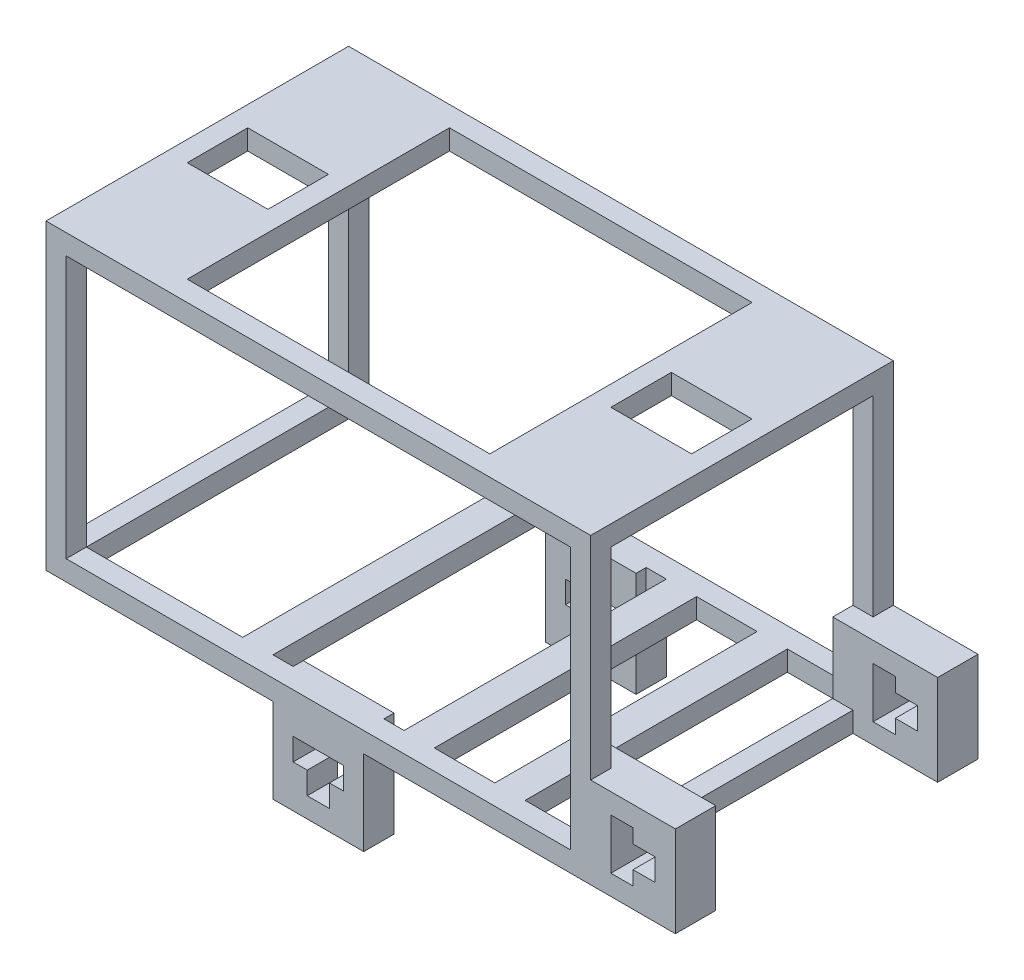
from build123d import *

# Parameters (mm, degrees)
SKETCH1_W           = 54
SKETCH1_H           = 30
SKETCH1_W_2         = 50
SKETCH1_H_2         = 26
BOSS_EXTRUDE1_DEPTH = 2
SKETCH2_W           = 2
SKETCH2_H           = 2
BOSS_EXTRUDE2_DEPTH = 28
SKETCH3_W           = 2
SKETCH3_H           = 9
BOSS_EXTRUDE3_DEPTH = 4
BOSS_EXTRUDE4_DEPTH = 3
SKETCH6_W           = 2
SKETCH6_H           = 2
BOSS_EXTRUDE5_DEPTH = 2
SKETCH10_W          = 3
SKETCH10_H          = 26
BOSS_EXTRUDE7_DEPTH = 2
SKETCH11_W          = 2
SKETCH11_H          = 6
BOSS_EXTRUDE9_DEPTH = 2


with BuildPart() as part:
    # Sketch1 → Boss-Extrude1 (new body)
    with BuildSketch(Plane(origin=(0, 0, 0), x_dir=(1, 0, 0), z_dir=(0, 1, 0))):
        Rectangle(SKETCH1_W, SKETCH1_H)
        Rectangle(SKETCH1_W_2, SKETCH1_H_2, mode=Mode.SUBTRACT)
    extrude(amount=BOSS_EXTRUDE1_DEPTH)

    # Sketch2 → Boss-Extrude2 (add)
    with BuildSketch(Plane(origin=(0, 0, 0), x_dir=(1, 0, 0), z_dir=(0, 1, 0))):
        with Locations((26, 14)):
            Rectangle(SKETCH2_W, SKETCH2_H)
        with Locations((26, -14)):
            Rectangle(SKETCH2_W, SKETCH2_H)
        with Locations((-26, -14)):
            Rectangle(SKETCH2_W, SKETCH2_H)
        with Locations((-26, 14)):
            Rectangle(SKETCH2_W, SKETCH2_H)
    extrude(amount=BOSS_EXTRUDE2_DEPTH)

    # Sketch3 → Boss-Extrude3 (add)
    with BuildSketch(Plane.XY.offset(15)):
        Polygon((27, 9), (27, 4.5), (29, 4.5), (29, 7), (31.2, 7), (31.2, 5.6), (33.4, 5.6), (33.4, 4.5), (35.4, 4.5), (35.4, 9), align=None)
        Polygon((27, 4.5), (27, 0), (35.4, 0), (35.4, 4.5), (33.4, 4.5), (33.4, 3.4), (31.2, 3.4), (31.2, 2), (29, 2), (29, 4.5), align=None)
        with Locations((26, 4.5)):
            Rectangle(SKETCH3_W, SKETCH3_H)
    boss_extrude3 = extrude(amount=-BOSS_EXTRUDE3_DEPTH)

    # Mirror1: Boss-Extrude3 across plane
    add(boss_extrude3.mirror(Plane.XY))

    # Sketch4 → Boss-Extrude4 (add)
    # profile 1 of 2: a face of its own
    with BuildSketch(Plane.XY.offset(15)):
        Polygon((-4.5, 0), (0, 0), (4.5, 0), (4.5, 2), (-4.5, 2), align=None)
    # profile 2 of 2: a face of its own
    with BuildSketch(Plane.XY.offset(15)):
        Polygon((4.5, 0), (0, 0), (-4.5, 0), (-4.5, -8.4), (0, -8.4), (4.5, -8.4), align=None)
        Polygon((1.1, -6.4), (0, -6.4), (-1.1, -6.4), (-1.1, -4.2), (-2.5, -4.2), (-2.5, -2), (2.5, -2), (2.5, -4.2), (1.1, -4.2), align=None, mode=Mode.SUBTRACT)
    boss_extrude4 = extrude(amount=-BOSS_EXTRUDE4_DEPTH)

    # Mirror2: Boss-Extrude4 across plane
    add(boss_extrude4.mirror(Plane.XY))

    # Sketch6 → Boss-Extrude5 (add)
    # profile 1 of 2: a face of its own
    with BuildSketch(Plane(origin=(0, 28, 0), x_dir=(1, 0, 0), z_dir=(0, 1, 0))):
        with Locations((26, -14)):
            Rectangle(SKETCH6_W, SKETCH6_H)
    # profile 2 of 2: a face of its own
    with BuildSketch(Plane(origin=(0, 28, 0), x_dir=(1, 0, 0), z_dir=(0, 1, 0))):
        Polygon((-27, -15), (25, -15), (25, -13), (27, -13), (27, 15), (-27, 15), align=None)
        Polygon((25, 6), (25, -13), (-25, -13), (-25, -9), (-25, 6), (-25, 9), (-25, 13), (25, 13), (25, 9), align=None, mode=Mode.SUBTRACT)
    extrude(amount=BOSS_EXTRUDE5_DEPTH)

    # Sketch10 → Boss-Extrude7 (add)
    with BuildSketch(Plane(origin=(0, 2, 0), x_dir=(1, 0, 0), z_dir=(0, 1, 0))):
        with Locations((8, 0)):
            Rectangle(SKETCH10_W, SKETCH10_H)
        with Locations((-8, 0)):
            Rectangle(SKETCH10_W, SKETCH10_H)
        with Locations((17, 0)):
            Rectangle(SKETCH10_W, SKETCH10_H)
    extrude(amount=-BOSS_EXTRUDE7_DEPTH)

    # Sketch11 → Boss-Extrude9 (add)
    with BuildSketch(Plane(origin=(0, 30, 0), x_dir=(1, 0, 0), z_dir=(0, 1, 0))):
        Polygon((15, -3), (15, -13), (25, -13), (25, -3), (17, -3), align=None)
        with Locations((16, 0)):
            Rectangle(SKETCH11_W, SKETCH11_H)
        Polygon((15, 13), (15, 3), (17, 3), (25, 3), (25, 13), align=None)
        Polygon((-17, 3), (-15, 3), (-15, 13), (-25, 13), (-25, 3), align=None)
        Polygon((-25, -3), (-25, -13), (-15, -13), (-15, -3), (-17, -3), align=None)
        with Locations((-16, 0)):
            Rectangle(SKETCH11_W, SKETCH11_H)
    extrude(amount=-BOSS_EXTRUDE9_DEPTH)


solid = part.part
